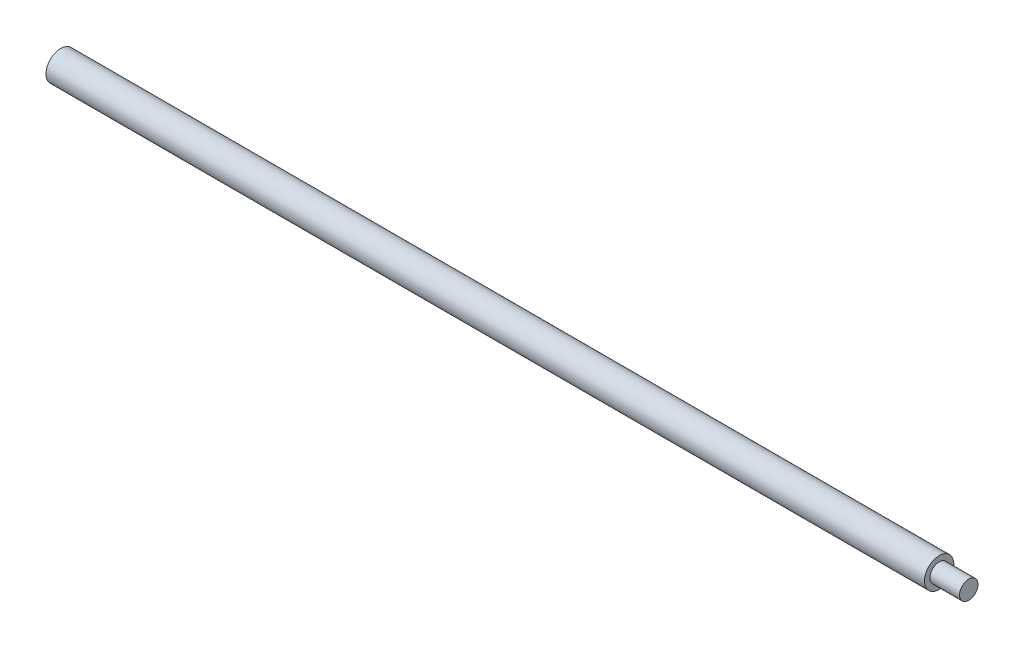
from build123d import *

# Parameters (mm, degrees)
SKETCH1_R           = 3.175
BOSS_EXTRUDE1_DEPTH = 95
SKETCH2_R           = 2
BOSS_EXTRUDE2_DEPTH = 6.4


with BuildPart() as part:
    # Sketch1 → Boss-Extrude1 (new, symmetric)
    with BuildSketch(Plane(origin=(0, 0, 0), x_dir=(0, 0, -1), z_dir=(1, 0, 0))):
        Circle(SKETCH1_R)
    extrude(amount=BOSS_EXTRUDE1_DEPTH, both=True)

    # Sketch2 → Boss-Extrude2 (add)
    with BuildSketch(Plane(origin=(95, 0, 0), x_dir=(0, 0, -1), z_dir=(1, 0, 0))):
        Circle(SKETCH2_R)
    extrude(amount=BOSS_EXTRUDE2_DEPTH)


solid = part.part
